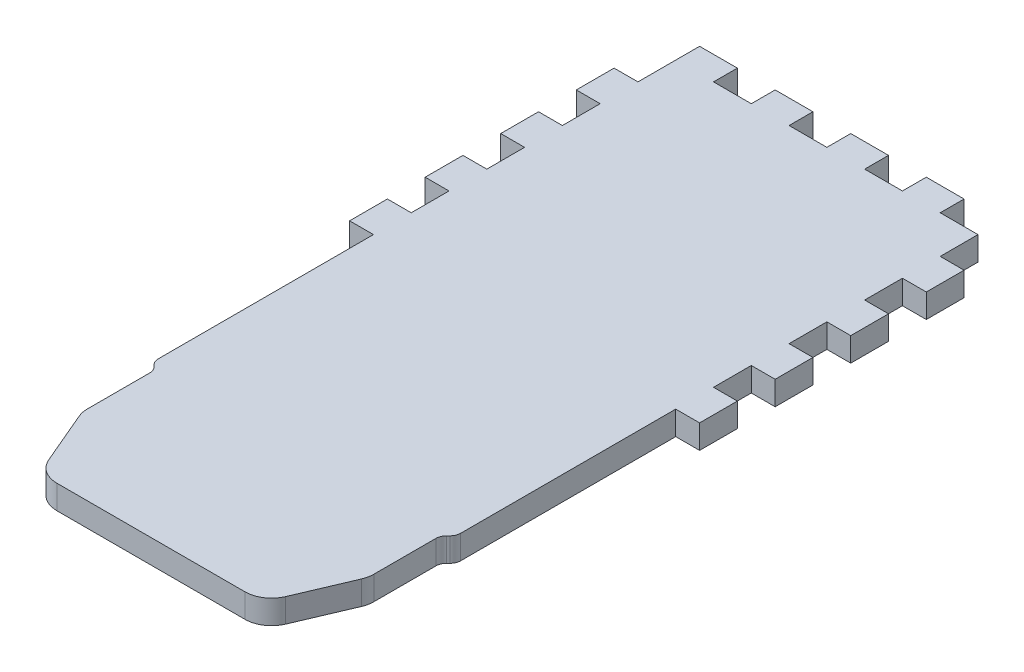
from build123d import *

# Parameters (mm, degrees)
EXTRUDE_1_DEPTH = 4.5


with BuildPart() as part:
    # 草图1 → 凸台-拉伸1 (new body)
    with BuildSketch(Plane(origin=(0, 0, 0), x_dir=(1, 0, 0), z_dir=(0, 1, 0))):
        with BuildLine():
            Line((-6.23452468, 62.552230204), (0.89047532, 62.552230204))
            Line((0.89047532, 62.552230204), (0.89047532, 67.052230204))
            Line((0.89047532, 67.052230204), (8.01547532, 67.052230204))
            Line((8.01547532, 67.052230204), (8.01547532, 62.552230204))
            Line((8.01547532, 62.552230204), (15.14047532, 62.552230204))
            Line((15.14047532, 62.552230204), (15.14047532, 67.052230204))
            Line((15.14047532, 67.052230204), (22.26547532, 67.052230204))
            Line((22.26547532, 67.052230204), (22.26547532, 62.552230204))
            Line((22.26547532, 62.552230204), (29.39047532, 62.552230204))
            Line((29.39047532, 62.552230204), (29.39047532, 55.427230204))
            Line((29.39047532, 55.427230204), (33.89047532, 55.427230204))
            Line((33.89047532, 55.427230204), (33.89047532, 48.302230204))
            Line((33.89047532, 48.302230204), (29.39047532, 48.302230204))
            Line((29.39047532, 48.302230204), (29.39047532, 41.177230204))
            Line((29.39047532, 41.177230204), (33.89047532, 41.177230204))
            Line((33.89047532, 41.177230204), (33.89047532, 34.052230204))
            Line((33.89047532, 34.052230204), (29.39047532, 34.052230204))
            Line((29.39047532, 34.052230204), (29.39047532, 26.927230204))
            Line((29.39047532, 26.927230204), (33.89047532, 26.927230204))
            Line((33.89047532, 26.927230204), (33.89047532, 19.802230204))
            Line((33.89047532, 19.802230204), (29.39047532, 19.802230204))
            Line((29.39047532, 19.802230204), (29.39047532, 12.677230204))
            Line((29.39047532, 12.677230204), (33.89047532, 12.677230204))
            Line((33.89047532, 12.677230204), (33.89047532, 5.552230204))
            Line((33.89047532, 5.552230204), (29.39047532, 5.552230204))
            Line((29.39047532, 5.552230204), (29.39047532, -34.999800679))
            ThreePointArc((29.39047532, -34.999800679), (29.238234385, -35.765167544), (28.804688882, -36.414014242))
            Line((28.804688882, -36.414014242), (28.476261758, -36.742441366))
            ThreePointArc((28.476261758, -36.742441366), (28.042716255, -37.391288064), (27.89047532, -38.156654929))
            Line((27.89047532, -38.156654929), (27.89047532, -49.877331374))
            ThreePointArc((27.89047532, -49.877331374), (27.789489805, -50.877159896), (27.49061249, -51.83660114))
            Line((27.49061249, -51.83660114), (23.222752356, -61.857039562))
            ThreePointArc((23.222752356, -61.857039562), (21.379756021, -64.068881688), (18.622615186, -64.897769796))
            Line((18.622615186, -64.897769796), (-16.841664546, -64.897769796))
            ThreePointArc((-16.841664546, -64.897769796), (-19.598805381, -64.068881688), (-21.441801716, -61.857039562))
            Line((-21.441801716, -61.857039562), (-25.70966185, -51.83660114))
            ThreePointArc((-25.70966185, -51.83660114), (-26.008539165, -50.877159896), (-26.10952468, -49.877331374))
            Line((-26.10952468, -49.877331374), (-26.10952468, -38.156654929))
            ThreePointArc((-26.10952468, -38.156654929), (-26.261765615, -37.391288064), (-26.695311118, -36.742441366))
            Line((-26.695311118, -36.742441366), (-27.023738242, -36.414014242))
            ThreePointArc((-27.023738242, -36.414014242), (-27.457283745, -35.765167544), (-27.60952468, -34.999800679))
            Line((-27.60952468, -34.999800679), (-27.60952468, 5.552230204))
            Line((-27.60952468, 5.552230204), (-32.10952468, 5.552230204))
            Line((-32.10952468, 5.552230204), (-32.10952468, 12.677230204))
            Line((-32.10952468, 12.677230204), (-27.60952468, 12.677230204))
            Line((-27.60952468, 12.677230204), (-27.60952468, 19.802230204))
            Line((-27.60952468, 19.802230204), (-32.10952468, 19.802230204))
            Line((-32.10952468, 19.802230204), (-32.10952468, 26.927230204))
            Line((-32.10952468, 26.927230204), (-27.60952468, 26.927230204))
            Line((-27.60952468, 26.927230204), (-27.60952468, 34.052230204))
            Line((-27.60952468, 34.052230204), (-32.10952468, 34.052230204))
            Line((-32.10952468, 34.052230204), (-32.10952468, 41.177230204))
            Line((-32.10952468, 41.177230204), (-27.60952468, 41.177230204))
            Line((-27.60952468, 41.177230204), (-27.60952468, 48.302230204))
            Line((-27.60952468, 48.302230204), (-32.10952468, 48.302230204))
            Line((-32.10952468, 48.302230204), (-32.10952468, 55.427230204))
            Line((-32.10952468, 55.427230204), (-27.60952468, 55.427230204))
            Line((-27.60952468, 55.427230204), (-27.60952468, 67.052230204))
            Line((-27.60952468, 67.052230204), (-20.48452468, 67.052230204))
            Line((-20.48452468, 67.052230204), (-20.48452468, 62.552230204))
            Line((-20.48452468, 62.552230204), (-13.35952468, 62.552230204))
            Line((-13.35952468, 62.552230204), (-13.35952468, 67.052230204))
            Line((-13.35952468, 67.052230204), (-6.23452468, 67.052230204))
            Line((-6.23452468, 67.052230204), (-6.23452468, 62.552230204))
        make_face()
    extrude(amount=EXTRUDE_1_DEPTH)


solid = part.part
